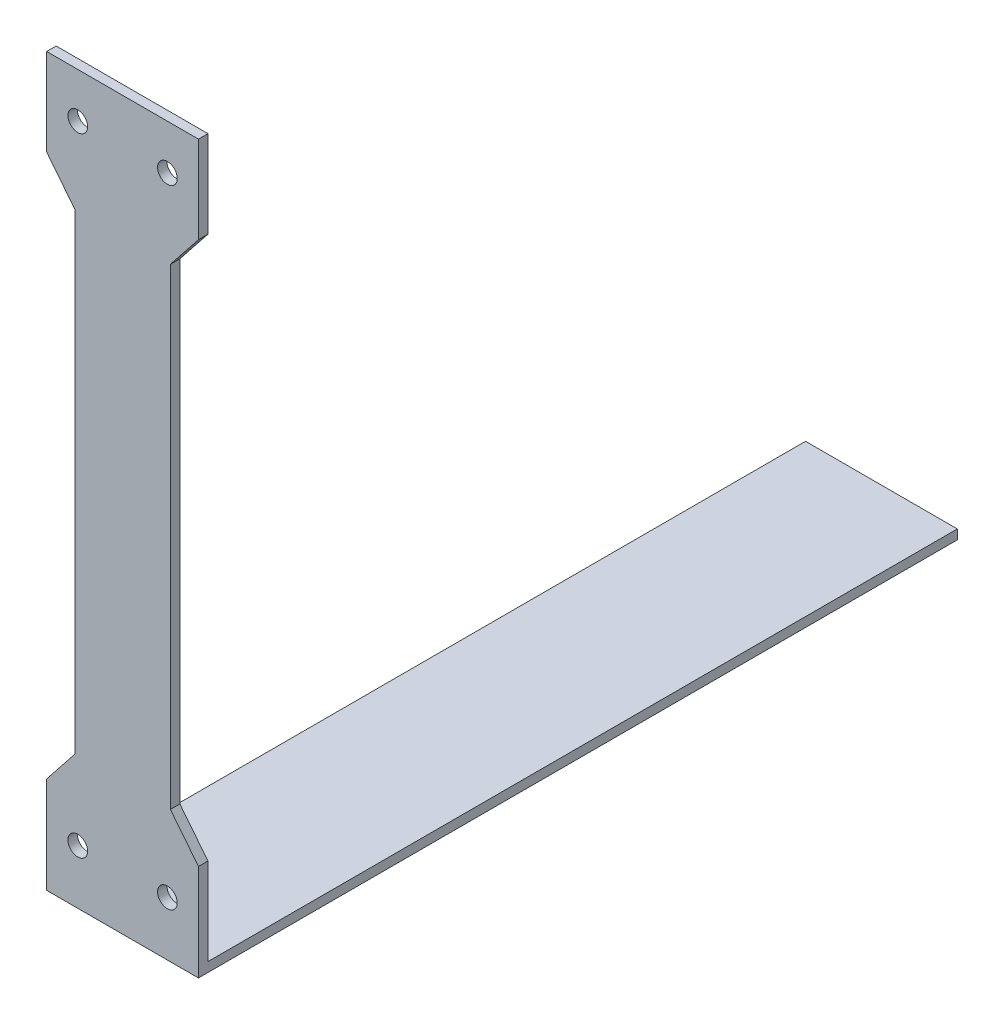
from build123d import *

# Parameters (mm, degrees)
BOSS_EXTRUDE1_DEPTH = 1.5875
SKETCH2_W           = 25.4
SKETCH2_H           = 127
BOSS_EXTRUDE2_DEPTH = 1.5875


with BuildPart() as part:
    # Sketch1 → Boss-Extrude1 (new body)
    with BuildSketch(Plane.XY):
        Polygon((-117, 20.5), (-117, 99.5), (-112.3, 105.418518519), (-112.3, 120), (-137.7, 120), (-137.7, 105.418518519), (-133, 99.5), (-133, 20.5), (-137.7, 14.581481481), (-137.7, 0), (-112.3, 0), (-112.3, 14.581481481), align=None)
        with BuildLine():
            ThreePointArc((-130.85, 7.5), (-132.5, 5.85), (-134.15, 7.5))
            ThreePointArc((-134.15, 7.5), (-132.5, 9.15), (-130.85, 7.5))
        make_face(mode=Mode.SUBTRACT)
        with BuildLine():
            ThreePointArc((-119.15, 7.5), (-117.5, 9.15), (-115.85, 7.5))
            ThreePointArc((-115.85, 7.5), (-117.5, 5.85), (-119.15, 7.5))
        make_face(mode=Mode.SUBTRACT)
        with BuildLine():
            ThreePointArc((-130.85, 112.5), (-132.5, 110.85), (-134.15, 112.5))
            ThreePointArc((-134.15, 112.5), (-132.5, 114.15), (-130.85, 112.5))
        make_face(mode=Mode.SUBTRACT)
        with BuildLine():
            ThreePointArc((-115.85, 112.5), (-117.5, 110.85), (-119.15, 112.5))
            ThreePointArc((-119.15, 112.5), (-117.5, 114.15), (-115.85, 112.5))
        make_face(mode=Mode.SUBTRACT)
    extrude(amount=BOSS_EXTRUDE1_DEPTH)

    # Sketch2 → Boss-Extrude2 (add)
    with BuildSketch(Plane(origin=(0, 0, 0), x_dir=(1, 0, 0), z_dir=(0, 1, 0))):
        with Locations((-125, 61.9125)):
            Rectangle(SKETCH2_W, SKETCH2_H)
    extrude(amount=-BOSS_EXTRUDE2_DEPTH)


solid = part.part
